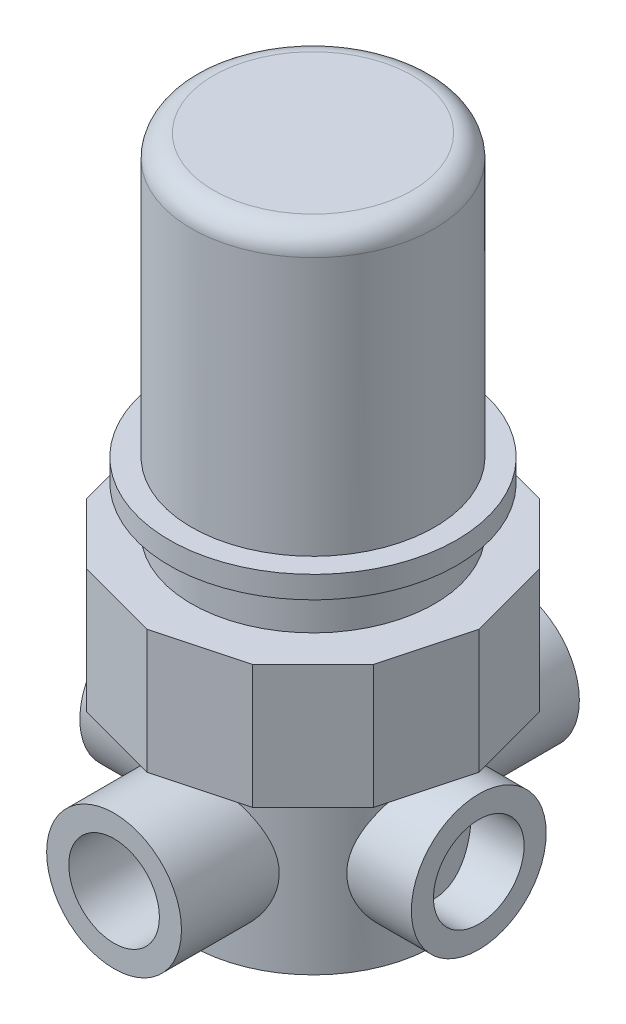
from build123d import *

# Parameters (mm, degrees)
CUT_EXTRUDE1_START  = -14.224
CUT_EXTRUDE1_DEPTH  = 14.224
SKETCH3_R           = 7.747
SKETCH3_R_2         = 5.207
BOSS_EXTRUDE1_DEPTH = 8.89
CIRPATTERN1_COUNT   = 4
SKETCH4_R           = 7.747
CUT_EXTRUDE2_DEPTH  = 3.81
FILLET1_R           = 2.54


with BuildPart() as part:
    # Sketch1 → Revolve1 (revolve)
    with BuildSketch(Plane.XY, mode=Mode.PRIVATE) as revolve1_sk:
        Polygon((0, 73.914), (13.97, 73.914), (13.97, 41.656), (16.51, 41.656), (16.51, 39.116), (13.97, 39.116), (13.97, 34.036), (19.05, 34.036), (19.05, 19.812), (13.97, 19.812), (13.97, 0), (0, 0), align=None)
    revolve(revolve1_sk.sketch.rotate(Axis((0, 73.914, 0), (0, -1, 0)), 180), axis=Axis((0, 73.914, 0), (0, -1, 0)))

    # Sketch2 → Cut-Extrude1 (cut)
    with BuildSketch(Plane(origin=(0, 34.036, 0), x_dir=(1, 0, 0), z_dir=(0, 1, 0)).offset(CUT_EXTRUDE1_START)):
        with BuildLine():
            ThreePointArc((9.525, 16.497783942), (4.930502809, 18.400886991), (0, 19.05))
            Line((0, 19.05), (9.525, 16.497783942))
        make_face()
        with BuildLine():
            Line((-9.525, 16.497783942), (0, 19.05))
            ThreePointArc((0, 19.05), (-4.930502809, 18.400886991), (-9.525, 16.497783942))
        make_face()
        with BuildLine():
            Line((-16.497783942, 9.525), (-9.525, 16.497783942))
            ThreePointArc((-9.525, 16.497783942), (-13.470384182, 13.470384182), (-16.497783942, 9.525))
        make_face()
        with BuildLine():
            ThreePointArc((16.497783942, 9.525), (13.470384182, 13.470384182), (9.525, 16.497783942))
            Line((9.525, 16.497783942), (16.497783942, 9.525))
        make_face()
        with BuildLine():
            Line((-19.05, 0), (-16.497783942, 9.525))
            ThreePointArc((-16.497783942, 9.525), (-18.400886991, 4.930502809), (-19.05, 0))
        make_face()
        with BuildLine():
            ThreePointArc((19.05, 0), (18.400886991, 4.930502809), (16.497783942, 9.525))
            Line((16.497783942, 9.525), (19.05, 0))
        make_face()
        with BuildLine():
            Line((-16.497783942, -9.525), (-19.05, 0))
            ThreePointArc((-19.05, 0), (-18.400886991, -4.930502809), (-16.497783942, -9.525))
        make_face()
        with BuildLine():
            ThreePointArc((16.497783942, -9.525), (18.400886991, -4.930502809), (19.05, 0))
            Line((19.05, 0), (16.497783942, -9.525))
        make_face()
        with BuildLine():
            Line((-9.525, -16.497783942), (-16.497783942, -9.525))
            ThreePointArc((-16.497783942, -9.525), (-13.470384182, -13.470384182), (-9.525, -16.497783942))
        make_face()
        with BuildLine():
            ThreePointArc((9.525, -16.497783942), (13.470384182, -13.470384182), (16.497783942, -9.525))
            Line((16.497783942, -9.525), (9.525, -16.497783942))
        make_face()
        with BuildLine():
            Line((0, -19.05), (-9.525, -16.497783942))
            ThreePointArc((-9.525, -16.497783942), (-4.930502809, -18.400886991), (0, -19.05))
        make_face()
        with BuildLine():
            ThreePointArc((0, -19.05), (4.930502809, -18.400886991), (9.525, -16.497783942))
            Line((9.525, -16.497783942), (0, -19.05))
        make_face()
    extrude(amount=CUT_EXTRUDE1_DEPTH, mode=Mode.SUBTRACT)

    # Sketch3 → Boss-Extrude1 (add, symmetric)
    with BuildSketch(Plane.XY.offset(13.97)):
        with Locations(Location((0, 9.906, 0), (0, 0, 180))):
            Circle(SKETCH3_R)
        with Locations((0, 9.906)):
            Circle(SKETCH3_R_2, mode=Mode.SUBTRACT)
    boss_extrude1 = extrude(amount=BOSS_EXTRUDE1_DEPTH, both=True)

    # CirPattern1: Boss-Extrude1 ×4 about axis
    cirpattern1_axis = Axis((0, 0, 0), (0, 1, 0))
    for i in range(1, CIRPATTERN1_COUNT):
        add(boss_extrude1.rotate(cirpattern1_axis, i * 360 / CIRPATTERN1_COUNT))

    # Sketch4 → Cut-Extrude2 (cut)
    with BuildSketch(Plane(origin=(22.86, 0, 0), x_dir=(0, 0, -1), z_dir=(1, 0, 0))):
        with Locations(Location((0, 9.906, 0), (0, 0, 180))):
            Circle(SKETCH4_R)
    cut_extrude2 = extrude(amount=-CUT_EXTRUDE2_DEPTH, mode=Mode.SUBTRACT)

    # Mirror2: Cut-Extrude2 across plane
    add(cut_extrude2.mirror(Plane(origin=(0, 0, 0), x_dir=(0, 0, 1), z_dir=(1, 0, 0))), mode=Mode.SUBTRACT)

    # Fillet1
    fillet1_edges = [part.edges().sort_by_distance(p)[0] for p in [
        (13.97, 73.914, 0),
    ]]
    fillet(fillet1_edges, radius=FILLET1_R)


solid = part.part
